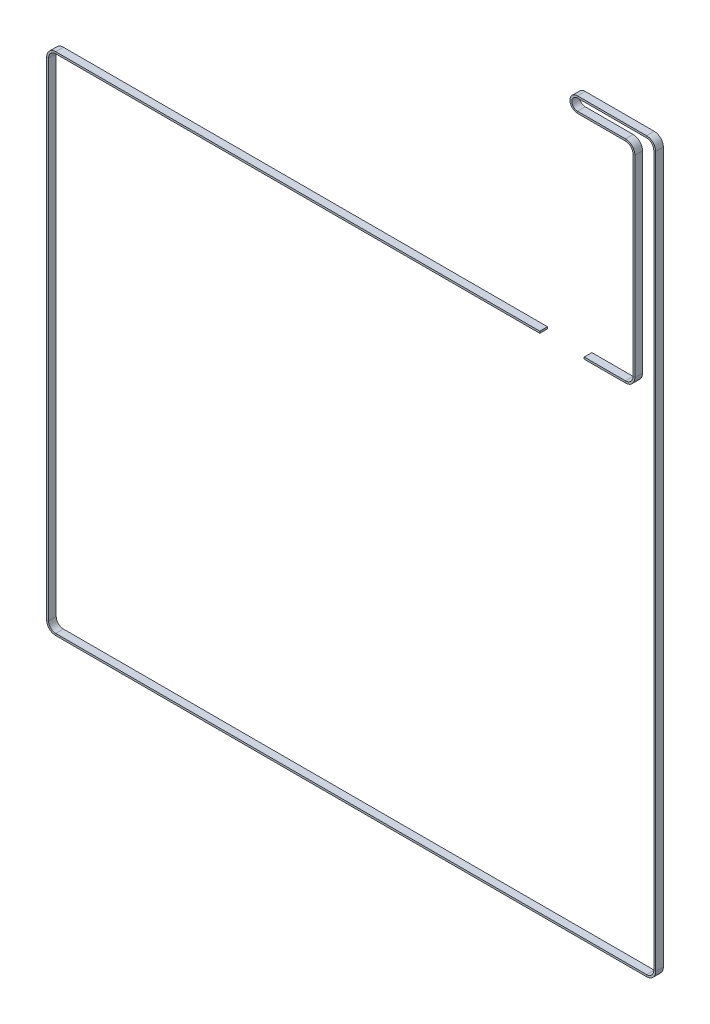
from build123d import *

# Parameters (mm, degrees)
SKETCH4_W = 6
SKETCH4_H = 1.5


with BuildPart() as part:
    # Sweep1: sweep along a path in Sketch1
    with BuildLine(Plane.XY.offset(2.2)) as sweep1_path:
        Line((347.817963112, -316.381982031), (-30.687774041, -316.381982031))
        ThreePointArc((-30.687774041, -316.381982031), (-35.195579771, -318.249176301), (-37.062774041, -322.756982031))
        Line((-37.062774041, -322.756982031), (-37.062774041, -703.985411885))
        ThreePointArc((-37.062774041, -703.985411885), (-35.195579771, -708.493217615), (-30.687774041, -710.360411885))
        Line((-30.687774041, -710.360411885), (431.312225959, -710.360411885))
        ThreePointArc((431.312225959, -710.360411885), (435.820031689, -708.493217615), (437.687225959, -703.985411885))
        Line((437.687225959, -703.985411885), (437.687225959, -148.660411885))
        ThreePointArc((437.687225959, -148.660411885), (435.820031689, -144.152606155), (431.312225959, -142.285411885))
        Line((431.312225959, -142.285411885), (377.312225959, -142.285411885))
        ThreePointArc((377.312225959, -142.285411885), (372.112225959, -147.485411885), (377.312225959, -152.685411885))
        Line((377.312225959, -152.685411885), (414.812225959, -152.685411885))
        ThreePointArc((414.812225959, -152.685411885), (419.479130714, -154.618507129), (421.412225959, -159.285411885))
        Line((421.412225959, -159.285411885), (421.412225959, -309.931982031))
        ThreePointArc((421.412225959, -309.931982031), (419.479130714, -314.598886787), (414.812225959, -316.531982031))
        Line((414.812225959, -316.531982031), (382.517963112, -316.531982031))
    # Sketch4 → Sweep1 (sweep)
    with BuildSketch(Plane(origin=(347.817963112, -316.381982031, 2.2), x_dir=(0, 0, -1), z_dir=(1, 0, 0))):
        Rectangle(SKETCH4_W, SKETCH4_H)
    sweep(path=sweep1_path.line)


solid = part.part
